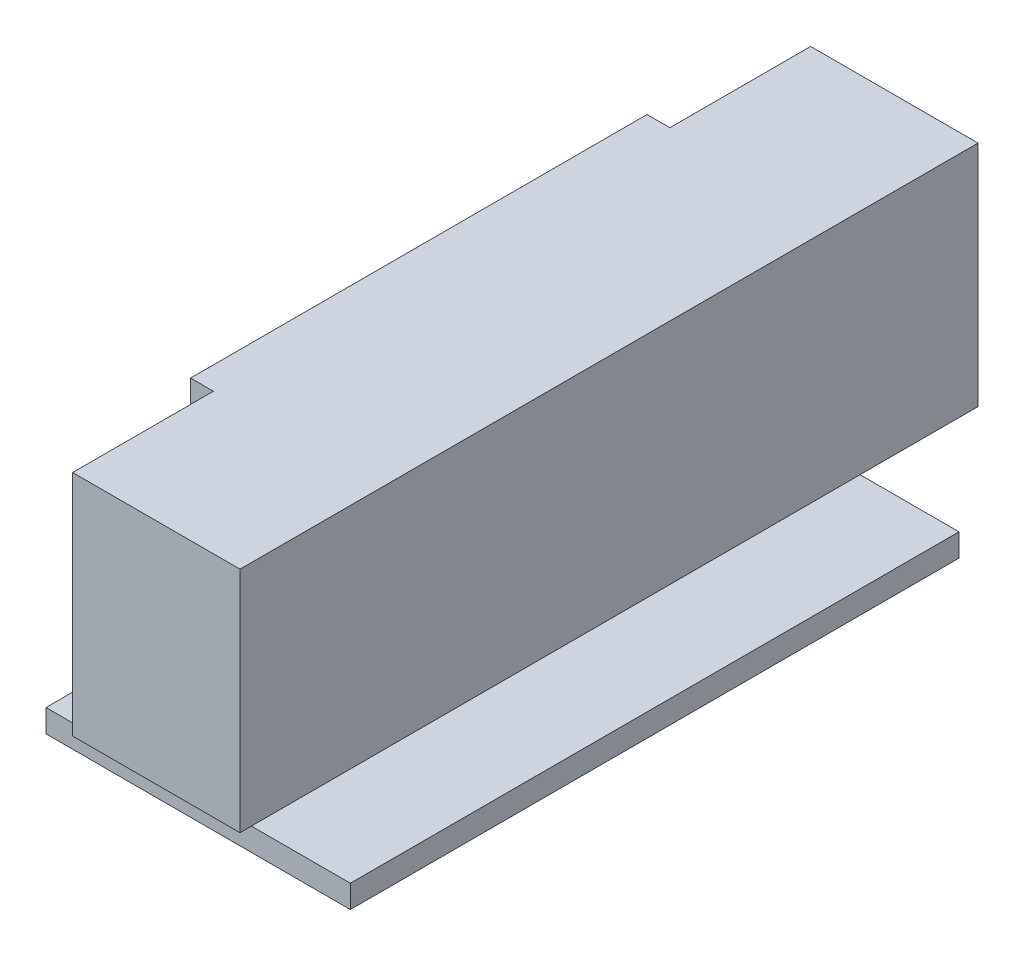
from build123d import *

# Parameters (mm, degrees)
SK_BRACKET_BASE_W     = 40
SK_BRACKET_BASE_H     = 3
BRACKET_BASE_DEPTH    = 40
SK_BRACKET_UPRIGHT_W  = 3
SK_BRACKET_UPRIGHT_H  = 40
BRACKET_UPRIGHT_DEPTH = 30
SK_CAMERA_W           = 22
SK_CAMERA_H           = 30
CAMERA_DEPTH          = 48.5


with BuildPart() as part:
    # SK_Bracket_Base → Bracket_Base (new, symmetric)
    with BuildSketch(Plane.XY):
        with Locations((-3, 1.5)):
            Rectangle(SK_BRACKET_BASE_W, SK_BRACKET_BASE_H)
    extrude(amount=BRACKET_BASE_DEPTH, both=True)

    # SK_Bracket_Upright → Bracket_Upright (add, symmetric)
    with BuildSketch(Plane.XY):
        with Locations((-12.5, 20)):
            Rectangle(SK_BRACKET_UPRIGHT_W, SK_BRACKET_UPRIGHT_H)
    extrude(amount=BRACKET_UPRIGHT_DEPTH, both=True)

    # SK_Camera → Camera (add, symmetric)
    with BuildSketch(Plane.XY):
        with Locations((0, 25)):
            Rectangle(SK_CAMERA_W, SK_CAMERA_H)
    extrude(amount=CAMERA_DEPTH, both=True)


solid = part.part
